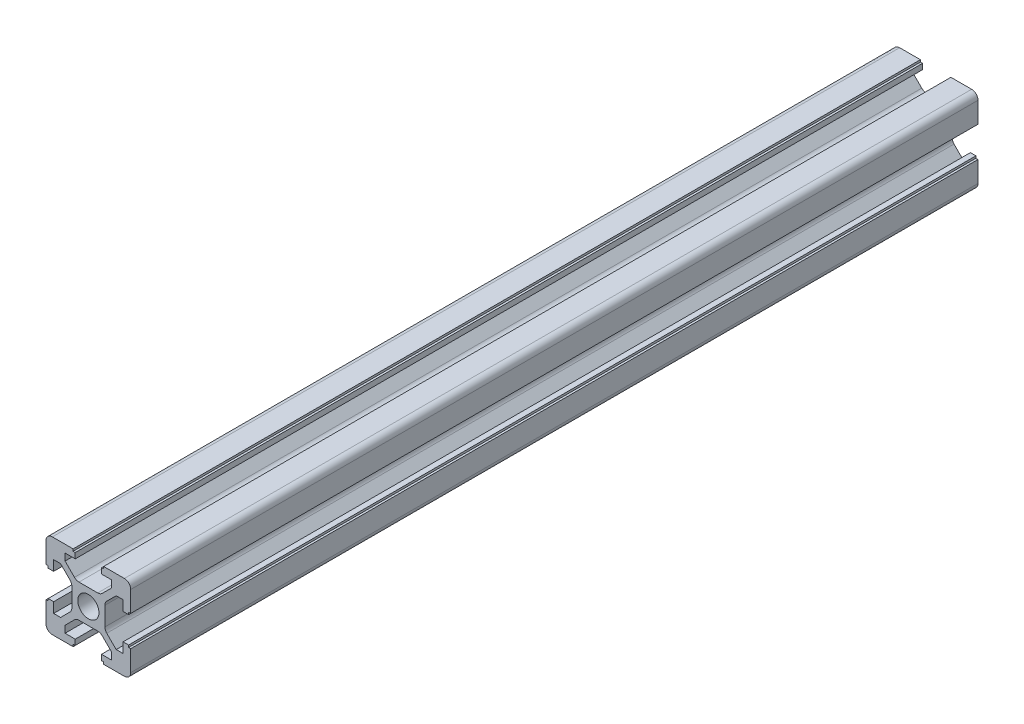
from build123d import *

# Parameters (mm, degrees)
SKETCH_1_R      = 2.5
EXTRUDE_1_DEPTH = 100


with BuildPart() as part:
    # 草图1 → 凸台-拉伸1 (new, symmetric)
    with BuildSketch(Plane.XY):
        with BuildLine():
            Line((-6.560660172, 5.5), (-4.339339828, 3.278679656))
            ThreePointArc((-4.339339828, 3.278679656), (-4.014180701, 2.792044633), (-3.9, 2.218019485))
            Line((-3.9, 2.218019485), (-3.9, -2.218019485))
            ThreePointArc((-3.9, -2.218019485), (-4.014180701, -2.792044633), (-4.339339828, -3.278679656))
            Line((-4.339339828, -3.278679656), (-6.560660172, -5.5))
            Line((-6.560660172, -5.5), (-8.2, -5.5))
            Line((-8.2, -5.5), (-8.2, -3.1))
            Line((-8.2, -3.1), (-9.5, -3.1))
            Line((-9.5, -3.1), (-9.5, -3.6))
            Line((-9.5, -3.6), (-10, -3.6))
            Line((-10, -3.6), (-10, -8.5))
            ThreePointArc((-10, -8.5), (-9.560660172, -9.560660172), (-8.5, -10))
            Line((-8.5, -10), (-3.6, -10))
            Line((-3.6, -10), (-3.6, -9.5))
            Line((-3.6, -9.5), (-3.1, -9.5))
            Line((-3.1, -9.5), (-3.1, -8.2))
            Line((-3.1, -8.2), (-5.5, -8.2))
            Line((-5.5, -8.2), (-5.5, -6.560660172))
            Line((-5.5, -6.560660172), (-3.278679656, -4.339339828))
            ThreePointArc((-3.278679656, -4.339339828), (-2.792044633, -4.014180701), (-2.218019485, -3.9))
            Line((-2.218019485, -3.9), (2.218019485, -3.9))
            ThreePointArc((2.218019485, -3.9), (2.792044633, -4.014180701), (3.278679656, -4.339339828))
            Line((3.278679656, -4.339339828), (5.5, -6.560660172))
            Line((5.5, -6.560660172), (5.5, -8.2))
            Line((5.5, -8.2), (3.1, -8.2))
            Line((3.1, -8.2), (3.1, -9.5))
            Line((3.1, -9.5), (3.6, -9.5))
            Line((3.6, -9.5), (3.6, -10))
            Line((3.6, -10), (8.5, -10))
            ThreePointArc((8.5, -10), (9.560660172, -9.560660172), (10, -8.5))
            Line((10, -8.5), (10, -3.6))
            Line((10, -3.6), (9.5, -3.6))
            Line((9.5, -3.6), (9.5, -3.1))
            Line((9.5, -3.1), (8.2, -3.1))
            Line((8.2, -3.1), (8.2, -5.5))
            Line((8.2, -5.5), (6.560660172, -5.5))
            Line((6.560660172, -5.5), (4.339339828, -3.278679656))
            ThreePointArc((4.339339828, -3.278679656), (4.014180701, -2.792044633), (3.9, -2.218019485))
            Line((3.9, -2.218019485), (3.9, 2.218019485))
            ThreePointArc((3.9, 2.218019485), (4.014180701, 2.792044633), (4.339339828, 3.278679656))
            Line((4.339339828, 3.278679656), (6.560660172, 5.5))
            Line((6.560660172, 5.5), (8.2, 5.5))
            Line((8.2, 5.5), (8.2, 3.1))
            Line((8.2, 3.1), (9.5, 3.1))
            Line((9.5, 3.1), (9.5, 3.6))
            Line((9.5, 3.6), (10, 3.6))
            Line((10, 3.6), (10, 8.5))
            ThreePointArc((10, 8.5), (9.560660172, 9.560660172), (8.5, 10))
            Line((8.5, 10), (3.6, 10))
            Line((3.6, 10), (3.6, 9.5))
            Line((3.6, 9.5), (3.1, 9.5))
            Line((3.1, 9.5), (3.1, 8.2))
            Line((3.1, 8.2), (5.5, 8.2))
            Line((5.5, 8.2), (5.5, 6.560660172))
            Line((5.5, 6.560660172), (3.278679656, 4.339339828))
            ThreePointArc((3.278679656, 4.339339828), (2.792044633, 4.014180701), (2.218019485, 3.9))
            Line((2.218019485, 3.9), (-2.218019485, 3.9))
            ThreePointArc((-2.218019485, 3.9), (-2.792044633, 4.014180701), (-3.278679656, 4.339339828))
            Line((-3.278679656, 4.339339828), (-5.5, 6.560660172))
            Line((-5.5, 6.560660172), (-5.5, 8.2))
            Line((-5.5, 8.2), (-3.1, 8.2))
            Line((-3.1, 8.2), (-3.1, 9.5))
            Line((-3.1, 9.5), (-3.6, 9.5))
            Line((-3.6, 9.5), (-3.6, 10))
            Line((-3.6, 10), (-8.5, 10))
            ThreePointArc((-8.5, 10), (-9.560660172, 9.560660172), (-10, 8.5))
            Line((-10, 8.5), (-10, 3.6))
            Line((-10, 3.6), (-9.5, 3.6))
            Line((-9.5, 3.6), (-9.5, 3.1))
            Line((-9.5, 3.1), (-8.2, 3.1))
            Line((-8.2, 3.1), (-8.2, 5.5))
            Line((-8.2, 5.5), (-6.560660172, 5.5))
        make_face()
        Circle(SKETCH_1_R, mode=Mode.SUBTRACT)
    extrude(amount=EXTRUDE_1_DEPTH, both=True)


solid = part.part
